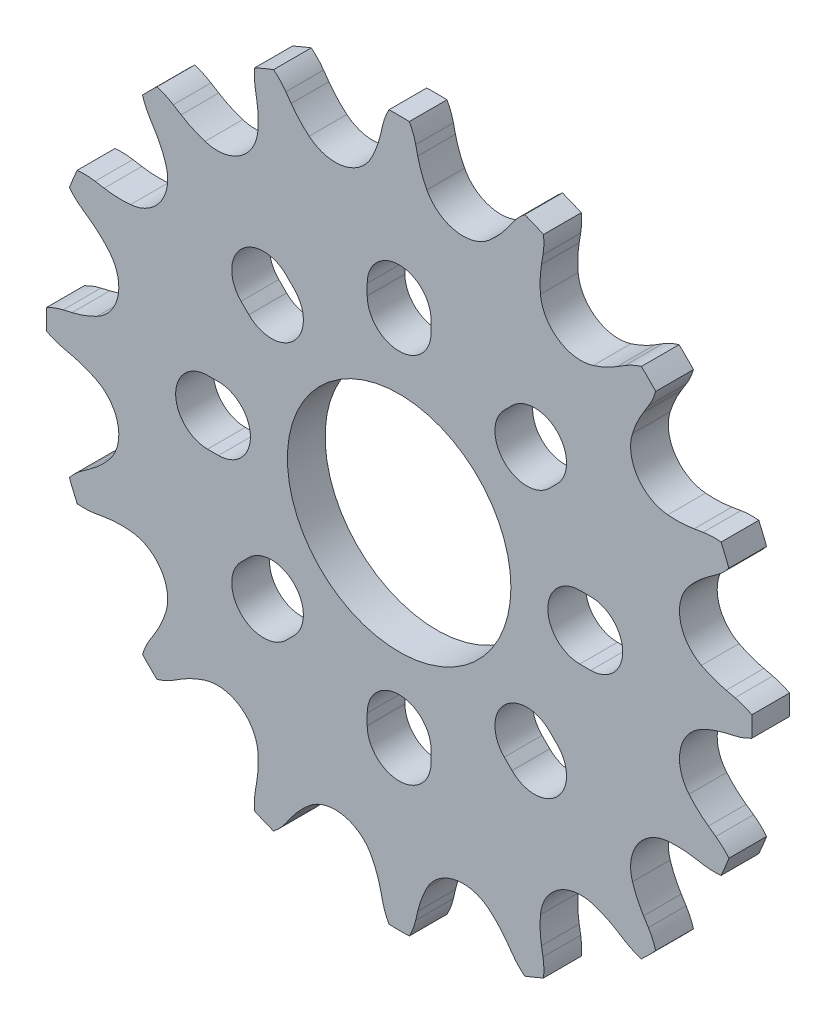
from build123d import *

# Parameters (mm, degrees)
SKETCH1_R           = 7
BOSS_EXTRUDE1_DEPTH = 2.3622


with BuildPart() as part:
    # Sketch1 → Boss-Extrude1 (new body)
    with BuildSketch(Plane(origin=(0, 0, -0.32013762), x_dir=(-1, 0, 0), z_dir=(0, 0, -1))):
        with BuildLine():
            Line((19.369582959, 6.761794676), (19.836182982, 7.094617237))
            ThreePointArc((19.836182982, 7.094617237), (20.270973765, 7.451678936), (20.653373066, 7.864361448))
            ThreePointArc((20.653373066, 7.864361448), (20.417737668, 8.457303855), (20.165083459, 9.04319684))
            ThreePointArc((20.165083459, 9.04319684), (19.602875717, 9.064610304), (19.042951458, 9.009647541))
            Line((19.042951458, 9.009647541), (18.477674328, 8.915052591))
            ThreePointArc((18.477674328, 8.915052591), (17.65368883, 8.830265328), (16.825591072, 8.850142063))
            ThreePointArc((16.825591072, 8.850142063), (14.927144116, 9.973998824), (14.615340055, 12.158016472))
            ThreePointArc((14.615340055, 12.158016472), (14.913875638, 12.930685539), (15.307534454, 13.659502194))
            Line((15.307534454, 13.659502194), (15.611250984, 14.145550245))
            ThreePointArc((15.611250984, 14.145550245), (15.876303693, 14.641819469), (16.071667821, 15.169426273))
            ThreePointArc((16.071667821, 15.169426273), (15.627059864, 15.627059864), (15.169426273, 16.071667821))
            ThreePointArc((15.169426273, 16.071667821), (14.641819469, 15.876303693), (14.145550245, 15.611250984))
            Line((14.145550245, 15.611250984), (13.659502194, 15.307534454))
            ThreePointArc((13.659502194, 15.307534454), (12.930685539, 14.913875638), (12.158016472, 14.615340055))
            ThreePointArc((12.158016472, 14.615340055), (9.973998824, 14.927144116), (8.850142063, 16.825591072))
            ThreePointArc((8.850142063, 16.825591072), (8.830265328, 17.65368883), (8.915052591, 18.477674328))
            Line((8.915052591, 18.477674328), (9.009647541, 19.042951458))
            ThreePointArc((9.009647541, 19.042951458), (9.064610304, 19.602875717), (9.04319684, 20.165083459))
            ThreePointArc((9.04319684, 20.165083459), (8.457303855, 20.417737668), (7.864361448, 20.653373066))
            ThreePointArc((7.864361448, 20.653373066), (7.451678936, 20.270973765), (7.094617237, 19.836182982))
            Line((7.094617237, 19.836182982), (6.761794676, 19.369582959))
            ThreePointArc((6.761794676, 19.369582959), (6.239102592, 18.726983577), (5.639494077, 18.155485012))
            ThreePointArc((5.639494077, 18.155485012), (3.502402625, 17.607767032), (1.737590169, 18.931621956))
            ThreePointArc((1.737590169, 18.931621956), (1.402327168, 19.689078027), (1.165334786, 20.482788045))
            Line((1.165334786, 20.482788045), (1.036406932, 21.041235936))
            ThreePointArc((1.036406932, 21.041235936), (0.872912166, 21.579571837), (0.637981117, 22.090789486))
            ThreePointArc((0.637981117, 22.090789486), (0, 22.1), (-0.637981117, 22.090789486))
            ThreePointArc((-0.637981117, 22.090789486), (-0.872912166, 21.579571837), (-1.036406932, 21.041235936))
            Line((-1.036406932, 21.041235936), (-1.165334786, 20.482788045))
            ThreePointArc((-1.165334786, 20.482788045), (-1.402327168, 19.689078027), (-1.737590169, 18.931621956))
            ThreePointArc((-1.737590169, 18.931621956), (-3.502402625, 17.607767032), (-5.639494077, 18.155485012))
            ThreePointArc((-5.639494077, 18.155485012), (-6.239102592, 18.726983577), (-6.761794676, 19.369582959))
            Line((-6.761794676, 19.369582959), (-7.094617237, 19.836182982))
            ThreePointArc((-7.094617237, 19.836182982), (-7.451678936, 20.270973765), (-7.864361448, 20.653373066))
            ThreePointArc((-7.864361448, 20.653373066), (-8.457303855, 20.417737668), (-9.04319684, 20.165083459))
            ThreePointArc((-9.04319684, 20.165083459), (-9.064610304, 19.602875717), (-9.009647541, 19.042951458))
            Line((-9.009647541, 19.042951458), (-8.915052591, 18.477674328))
            ThreePointArc((-8.915052591, 18.477674328), (-8.830265328, 17.65368883), (-8.850142063, 16.825591072))
            ThreePointArc((-8.850142063, 16.825591072), (-9.973998824, 14.927144116), (-12.158016472, 14.615340055))
            ThreePointArc((-12.158016472, 14.615340055), (-12.930685539, 14.913875638), (-13.659502194, 15.307534454))
            Line((-13.659502194, 15.307534454), (-14.145550245, 15.611250984))
            ThreePointArc((-14.145550245, 15.611250984), (-14.641819469, 15.876303693), (-15.169426273, 16.071667821))
            ThreePointArc((-15.169426273, 16.071667821), (-15.627059864, 15.627059864), (-16.071667821, 15.169426273))
            ThreePointArc((-16.071667821, 15.169426273), (-15.876303693, 14.641819469), (-15.611250984, 14.145550245))
            Line((-15.611250984, 14.145550245), (-15.307534454, 13.659502194))
            ThreePointArc((-15.307534454, 13.659502194), (-14.913875638, 12.930685539), (-14.615340055, 12.158016472))
            ThreePointArc((-14.615340055, 12.158016472), (-14.927144116, 9.973998824), (-16.825591072, 8.850142063))
            ThreePointArc((-16.825591072, 8.850142063), (-17.65368883, 8.830265328), (-18.477674328, 8.915052591))
            Line((-18.477674328, 8.915052591), (-19.042951458, 9.009647541))
            ThreePointArc((-19.042951458, 9.009647541), (-19.602875717, 9.064610304), (-20.165083459, 9.04319684))
            ThreePointArc((-20.165083459, 9.04319684), (-20.417737668, 8.457303855), (-20.653373066, 7.864361448))
            ThreePointArc((-20.653373066, 7.864361448), (-20.270973765, 7.451678936), (-19.836182982, 7.094617237))
            Line((-19.836182982, 7.094617237), (-19.369582959, 6.761794676))
            ThreePointArc((-19.369582959, 6.761794676), (-18.726983577, 6.239102592), (-18.155485012, 5.639494077))
            ThreePointArc((-18.155485012, 5.639494077), (-17.607767032, 3.502402625), (-18.931621956, 1.737590169))
            ThreePointArc((-18.931621956, 1.737590169), (-19.689078027, 1.402327168), (-20.482788045, 1.165334786))
            Line((-20.482788045, 1.165334786), (-21.041235936, 1.036406932))
            ThreePointArc((-21.041235936, 1.036406932), (-21.579571837, 0.872912166), (-22.090789486, 0.637981117))
            ThreePointArc((-22.090789486, 0.637981117), (-22.1, 0), (-22.090789486, -0.637981117))
            ThreePointArc((-22.090789486, -0.637981117), (-21.579571837, -0.872912166), (-21.041235936, -1.036406932))
            Line((-21.041235936, -1.036406932), (-20.482788045, -1.165334786))
            ThreePointArc((-20.482788045, -1.165334786), (-19.689078027, -1.402327168), (-18.931621956, -1.737590169))
            ThreePointArc((-18.931621956, -1.737590169), (-17.607767032, -3.502402625), (-18.155485012, -5.639494077))
            ThreePointArc((-18.155485012, -5.639494077), (-18.726983577, -6.239102592), (-19.369582959, -6.761794676))
            Line((-19.369582959, -6.761794676), (-19.836182982, -7.094617237))
            ThreePointArc((-19.836182982, -7.094617237), (-20.270973765, -7.451678936), (-20.653373066, -7.864361448))
            ThreePointArc((-20.653373066, -7.864361448), (-20.417737668, -8.457303855), (-20.165083459, -9.04319684))
            ThreePointArc((-20.165083459, -9.04319684), (-19.602875717, -9.064610304), (-19.042951458, -9.009647541))
            Line((-19.042951458, -9.009647541), (-18.477674328, -8.915052591))
            ThreePointArc((-18.477674328, -8.915052591), (-17.65368883, -8.830265328), (-16.825591072, -8.850142063))
            ThreePointArc((-16.825591072, -8.850142063), (-14.927144116, -9.973998824), (-14.615340055, -12.158016472))
            ThreePointArc((-14.615340055, -12.158016472), (-14.913875638, -12.930685539), (-15.307534454, -13.659502194))
            Line((-15.307534454, -13.659502194), (-15.611250984, -14.145550245))
            ThreePointArc((-15.611250984, -14.145550245), (-15.876303693, -14.641819469), (-16.071667821, -15.169426273))
            ThreePointArc((-16.071667821, -15.169426273), (-15.627059864, -15.627059864), (-15.169426273, -16.071667821))
            ThreePointArc((-15.169426273, -16.071667821), (-14.641819469, -15.876303693), (-14.145550245, -15.611250984))
            Line((-14.145550245, -15.611250984), (-13.659502194, -15.307534454))
            ThreePointArc((-13.659502194, -15.307534454), (-12.930685539, -14.913875638), (-12.158016472, -14.615340055))
            ThreePointArc((-12.158016472, -14.615340055), (-9.973998824, -14.927144116), (-8.850142063, -16.825591072))
            ThreePointArc((-8.850142063, -16.825591072), (-8.830265328, -17.65368883), (-8.915052591, -18.477674328))
            Line((-8.915052591, -18.477674328), (-9.009647541, -19.042951458))
            ThreePointArc((-9.009647541, -19.042951458), (-9.064610304, -19.602875717), (-9.04319684, -20.165083459))
            ThreePointArc((-9.04319684, -20.165083459), (-8.457303855, -20.417737668), (-7.864361448, -20.653373066))
            ThreePointArc((-7.864361448, -20.653373066), (-7.451678936, -20.270973765), (-7.094617237, -19.836182982))
            Line((-7.094617237, -19.836182982), (-6.761794676, -19.369582959))
            ThreePointArc((-6.761794676, -19.369582959), (-6.239102592, -18.726983577), (-5.639494077, -18.155485012))
            ThreePointArc((-5.639494077, -18.155485012), (-3.502402625, -17.607767032), (-1.737590169, -18.931621956))
            ThreePointArc((-1.737590169, -18.931621956), (-1.402327168, -19.689078027), (-1.165334786, -20.482788045))
            Line((-1.165334786, -20.482788045), (-1.036406932, -21.041235936))
            ThreePointArc((-1.036406932, -21.041235936), (-0.872912166, -21.579571837), (-0.637981117, -22.090789486))
            ThreePointArc((-0.637981117, -22.090789486), (0, -22.1), (0.637981117, -22.090789486))
            ThreePointArc((0.637981117, -22.090789486), (0.872912166, -21.579571837), (1.036406932, -21.041235936))
            Line((1.036406932, -21.041235936), (1.165334786, -20.482788045))
            ThreePointArc((1.165334786, -20.482788045), (1.402327168, -19.689078027), (1.737590169, -18.931621956))
            ThreePointArc((1.737590169, -18.931621956), (3.502402625, -17.607767032), (5.639494077, -18.155485012))
            ThreePointArc((5.639494077, -18.155485012), (6.239102592, -18.726983577), (6.761794676, -19.369582959))
            Line((6.761794676, -19.369582959), (7.094617237, -19.836182982))
            ThreePointArc((7.094617237, -19.836182982), (7.451678936, -20.270973765), (7.864361448, -20.653373066))
            ThreePointArc((7.864361448, -20.653373066), (8.457303855, -20.417737668), (9.04319684, -20.165083459))
            ThreePointArc((9.04319684, -20.165083459), (9.064610304, -19.602875717), (9.009647541, -19.042951458))
            Line((9.009647541, -19.042951458), (8.915052591, -18.477674328))
            ThreePointArc((8.915052591, -18.477674328), (8.830265328, -17.65368883), (8.850142063, -16.825591072))
            ThreePointArc((8.850142063, -16.825591072), (9.973998824, -14.927144116), (12.158016472, -14.615340055))
            ThreePointArc((12.158016472, -14.615340055), (12.930685539, -14.913875638), (13.659502194, -15.307534454))
            Line((13.659502194, -15.307534454), (14.145550245, -15.611250984))
            ThreePointArc((14.145550245, -15.611250984), (14.641819469, -15.876303693), (15.169426273, -16.071667821))
            ThreePointArc((15.169426273, -16.071667821), (15.627059864, -15.627059864), (16.071667821, -15.169426273))
            ThreePointArc((16.071667821, -15.169426273), (15.876303693, -14.641819469), (15.611250984, -14.145550245))
            Line((15.611250984, -14.145550245), (15.307534454, -13.659502194))
            ThreePointArc((15.307534454, -13.659502194), (14.913875638, -12.930685539), (14.615340055, -12.158016472))
            ThreePointArc((14.615340055, -12.158016472), (14.927144116, -9.973998824), (16.825591072, -8.850142063))
            ThreePointArc((16.825591072, -8.850142063), (17.65368883, -8.830265328), (18.477674328, -8.915052591))
            Line((18.477674328, -8.915052591), (19.042951458, -9.009647541))
            ThreePointArc((19.042951458, -9.009647541), (19.602875717, -9.064610304), (20.165083459, -9.04319684))
            ThreePointArc((20.165083459, -9.04319684), (20.417737668, -8.457303855), (20.653373066, -7.864361448))
            ThreePointArc((20.653373066, -7.864361448), (20.270973765, -7.451678936), (19.836182982, -7.094617237))
            Line((19.836182982, -7.094617237), (19.369582959, -6.761794676))
            ThreePointArc((19.369582959, -6.761794676), (18.726983577, -6.239102592), (18.155485012, -5.639494077))
            ThreePointArc((18.155485012, -5.639494077), (17.607767032, -3.502402625), (18.931621956, -1.737590169))
            ThreePointArc((18.931621956, -1.737590169), (19.689078027, -1.402327168), (20.482788045, -1.165334786))
            Line((20.482788045, -1.165334786), (21.041235936, -1.036406932))
            ThreePointArc((21.041235936, -1.036406932), (21.579571837, -0.872912166), (22.090789486, -0.637981117))
            ThreePointArc((22.090789486, -0.637981117), (22.1, 0), (22.090789486, 0.637981117))
            ThreePointArc((22.090789486, 0.637981117), (21.579571837, 0.872912166), (21.041235936, 1.036406932))
            Line((21.041235936, 1.036406932), (20.482788045, 1.165334786))
            ThreePointArc((20.482788045, 1.165334786), (19.689078027, 1.402327168), (18.931621956, 1.737590169))
            ThreePointArc((18.931621956, 1.737590169), (17.607767032, 3.502402625), (18.155485012, 5.639494077))
            ThreePointArc((18.155485012, 5.639494077), (18.726983577, 6.239102592), (19.369582959, 6.761794676))
        make_face()
        with Locations(Location((0, 0, 0), (0, 0, 180))):
            Circle(SKETCH1_R, mode=Mode.SUBTRACT)
        with BuildLine():
            Line((-2, 11.313708499), (-2, 12))
            ThreePointArc((-2, 12), (0, 14), (2, 12))
            Line((2, 12), (2, 11.313708499))
            ThreePointArc((2, 11.313708499), (0, 9.313708499), (-2, 11.313708499))
        make_face(mode=Mode.SUBTRACT)
        with BuildLine():
            Line((6.585786438, 9.414213562), (7.071067812, 9.899494937))
            ThreePointArc((7.071067812, 9.899494937), (9.899494937, 9.899494937), (9.899494937, 7.071067812))
            Line((9.899494937, 7.071067812), (9.414213562, 6.585786438))
            ThreePointArc((9.414213562, 6.585786438), (6.585786438, 6.585786438), (6.585786438, 9.414213562))
        make_face(mode=Mode.SUBTRACT)
        with BuildLine():
            Line((-9.414213562, 6.585786438), (-9.899494937, 7.071067812))
            ThreePointArc((-9.899494937, 7.071067812), (-9.899494937, 9.899494937), (-7.071067812, 9.899494937))
            Line((-7.071067812, 9.899494937), (-6.585786438, 9.414213562))
            ThreePointArc((-6.585786438, 9.414213562), (-6.585786438, 6.585786438), (-9.414213562, 6.585786438))
        make_face(mode=Mode.SUBTRACT)
        with BuildLine():
            Line((-11.313708499, -2), (-12, -2))
            ThreePointArc((-12, -2), (-14, 0), (-12, 2))
            Line((-12, 2), (-11.313708499, 2))
            ThreePointArc((-11.313708499, 2), (-9.313708499, 0), (-11.313708499, -2))
        make_face(mode=Mode.SUBTRACT)
        with BuildLine():
            Line((-9.899494937, -7.071067812), (-9.414213562, -6.585786438))
            ThreePointArc((-9.414213562, -6.585786438), (-6.585786438, -6.585786438), (-6.585786438, -9.414213562))
            Line((-6.585786438, -9.414213562), (-7.071067812, -9.899494937))
            ThreePointArc((-7.071067812, -9.899494937), (-9.899494937, -9.899494937), (-9.899494937, -7.071067812))
        make_face(mode=Mode.SUBTRACT)
        with BuildLine():
            Line((2, -11.313708499), (2, -12))
            ThreePointArc((2, -12), (0, -14), (-2, -12))
            Line((-2, -12), (-2, -11.313708499))
            ThreePointArc((-2, -11.313708499), (0, -9.313708499), (2, -11.313708499))
        make_face(mode=Mode.SUBTRACT)
        with BuildLine():
            Line((9.414213562, -6.585786438), (9.899494937, -7.071067812))
            ThreePointArc((9.899494937, -7.071067812), (9.899494937, -9.899494937), (7.071067812, -9.899494937))
            Line((7.071067812, -9.899494937), (6.585786438, -9.414213562))
            ThreePointArc((6.585786438, -9.414213562), (6.585786438, -6.585786438), (9.414213562, -6.585786438))
        make_face(mode=Mode.SUBTRACT)
        with BuildLine():
            Line((11.313708499, 2), (12, 2))
            ThreePointArc((12, 2), (14, 0), (12, -2))
            Line((12, -2), (11.313708499, -2))
            ThreePointArc((11.313708499, -2), (9.313708499, 0), (11.313708499, 2))
        make_face(mode=Mode.SUBTRACT)
    extrude(amount=-BOSS_EXTRUDE1_DEPTH)


solid = part.part
